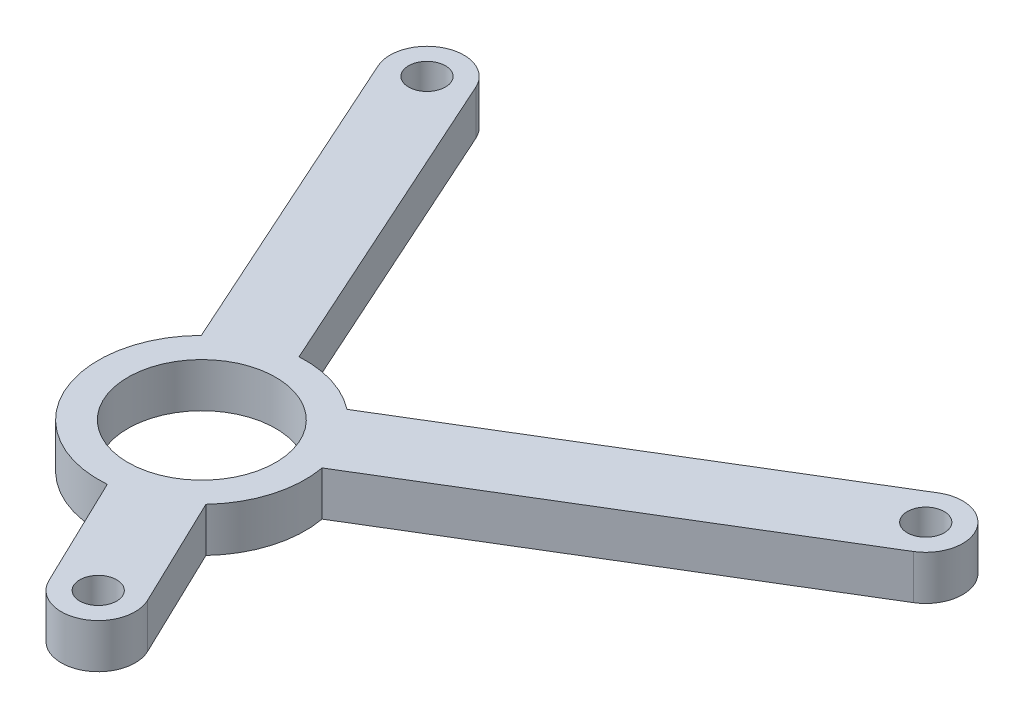
from build123d import *

# Parameters (mm, degrees)
SKETCH1_R           = 27.5
BOSS_EXTRUDE1_DEPTH = 3
SKETCH2_R           = 1.25
CUT_EXTRUDE1_DEPTH  = 3
CUT_EXTRUDE5_START  = -3
SKETCH3_R           = 5
SKETCH3_R_2         = 1.25
CUT_EXTRUDE5_DEPTH  = 3


with BuildPart() as part:
    # Sketch1 → Boss-Extrude1 (new body)
    with BuildSketch(Plane(origin=(0, 0, 0), x_dir=(1, 0, 0), z_dir=(0, 1, 0))):
        with Locations(Location((0, 0, 0), (0, 0, 270))):
            Circle(SKETCH1_R)
    extrude(amount=BOSS_EXTRUDE1_DEPTH)

    # Sketch2 → Cut-Extrude1 (cut)
    with BuildSketch(Plane(origin=(0, 3, 0), x_dir=(1, 0, 0), z_dir=(0, 1, 0))):
        with Locations(Location((0, -25, 0), (0, 0, 270))):
            Circle(SKETCH2_R)
        with Locations(Location((24, 7, 0), (0, 0, 270))):
            Circle(SKETCH2_R)
        with Locations(Location((-19, 16.248076809, 0), (0, 0, 270))):
            Circle(SKETCH2_R)
    extrude(amount=-CUT_EXTRUDE1_DEPTH, mode=Mode.SUBTRACT)

    # Sketch3 → Cut-Extrude5 (cut)
    with BuildSketch(Plane(origin=(0, 3, 0), x_dir=(1, 0, 0), z_dir=(0, 1, 0)).offset(CUT_EXTRUDE5_START)):
        with BuildLine():
            Line((-2.196984727, -5.970983825), (22.703158369, 9.137335206))
            ThreePointArc((22.703158369, 9.137335206), (24.905937464, 9.330080967), (26.399999989, 7.700000036))
            ThreePointArc((26.399999989, 7.700000036), (5.782248195, 26.885230254), (-20.900000036, 17.872884448))
            ThreePointArc((-20.900000036, 17.872884448), (-18.646279407, 18.722926652), (-16.720914968, 17.275584191))
            Line((-16.720914968, 17.275584191), (-6.898195472, -4.511911817))
            ThreePointArc((-6.898195472, -4.511911817), (-4.415107472, -4.814581464), (-2.196984727, -5.970983825))
        make_face()
        with BuildLine():
            ThreePointArc((26.5, 7), (26.178543559, 5.773644439), (25.296841631, 4.862664794))
            Line((25.296841631, 4.862664794), (0.396698535, -10.245654238))
            ThreePointArc((0.396698535, -10.245654238), (0.481617092, -10.870273767), (0.51, -11.5))
            ThreePointArc((0.51, -11.5), (0.013935278, -14.088209014), (-1.403950257, -16.309583974))
            Line((-1.403950257, -16.309583974), (2.253156128, -23.916816054))
            ThreePointArc((2.253156128, -23.916816054), (2.437507982, -24.444522872), (2.5, -25))
            ThreePointArc((2.5, -25), (1.767766953, -26.767766953), (0, -27.5))
            ThreePointArc((0, -27.5), (19.445436483, -19.445436483), (27.5, 0))
            ThreePointArc((27.5, 0), (27.223611073, 3.889087315), (26.399999989, 7.700000036))
            ThreePointArc((26.399999989, 7.700000036), (26.474873731, 7.353553409), (26.5, 7))
        make_face()
        with Locations(Location((-6.49, -11.5, 0), (0, 0, 270))):
            Circle(SKETCH3_R)
        with Locations(Location((0, -25, 0), (0, 0, 270))):
            Circle(SKETCH3_R_2)
        with Locations(Location((24, 7, 0), (0, 0, 270))):
            Circle(SKETCH3_R_2)
        with Locations(Location((-19, 16.248076809, 0), (0, 0, 270))):
            Circle(SKETCH3_R_2)
        with BuildLine():
            ThreePointArc((-21.279085032, 15.220569428), (-21.474849842, 16.601797402), (-20.900000036, 17.872884448))
            ThreePointArc((-20.900000036, 17.872884448), (-24.977533128, -11.505339579), (0, -27.5))
            ThreePointArc((0, -27.5), (-1.330796779, -27.116360067), (-2.253156128, -26.083183946))
            Line((-2.253156128, -26.083183946), (-5.910262513, -18.475951867))
            ThreePointArc((-5.910262513, -18.475951867), (-12.835616379, -14.455190818), (-11.456365535, -6.56692658))
            Line((-11.456365535, -6.56692658), (-21.279085032, 15.220569428))
        make_face()
    extrude(amount=CUT_EXTRUDE5_DEPTH, mode=Mode.SUBTRACT)


solid = part.part
